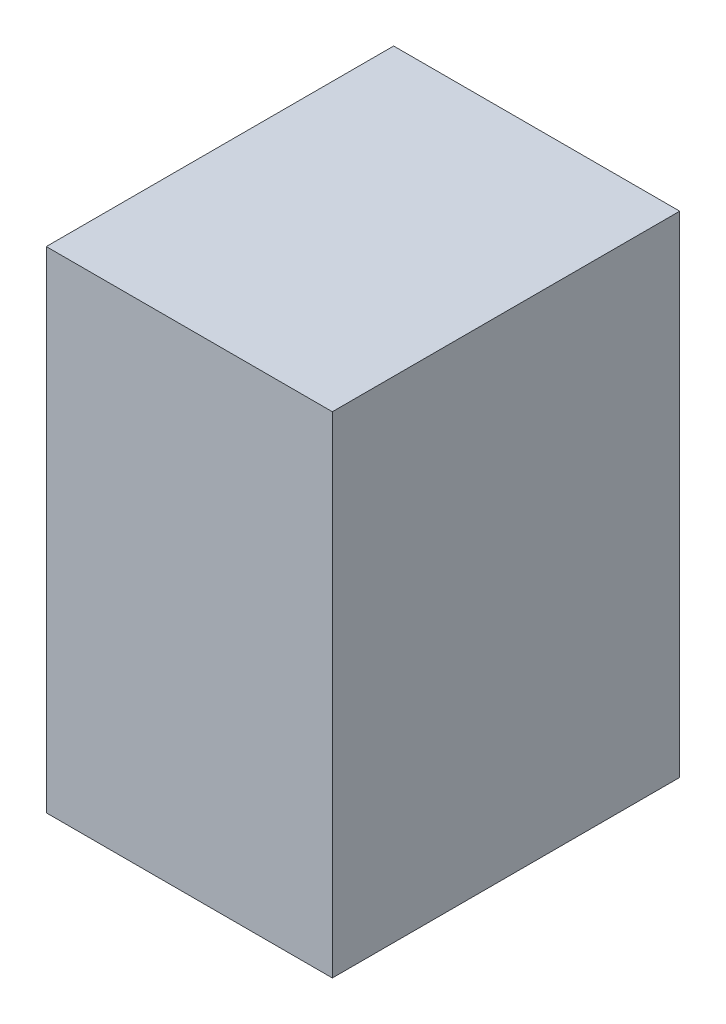
from build123d import *

# Parameters (mm, degrees)
SKETCH1_W           = 70
SKETCH1_H           = 85
BOSS_EXTRUDE1_DEPTH = 120
SHELL1_T            = -12


with BuildPart() as part:
    # Sketch1 → Boss-Extrude1 (new body)
    with BuildSketch(Plane(origin=(0, 0, 0), x_dir=(1, 0, 0), z_dir=(0, 1, 0))):
        Rectangle(SKETCH1_W, SKETCH1_H)
    extrude(amount=BOSS_EXTRUDE1_DEPTH)

    # Shell1
    shell1_openings = [part.faces().sort_by_distance(p)[0] for p in [
        (0, 0, 0),
    ]]
    offset(amount=SHELL1_T, openings=shell1_openings, kind=Kind.INTERSECTION)


solid = part.part
